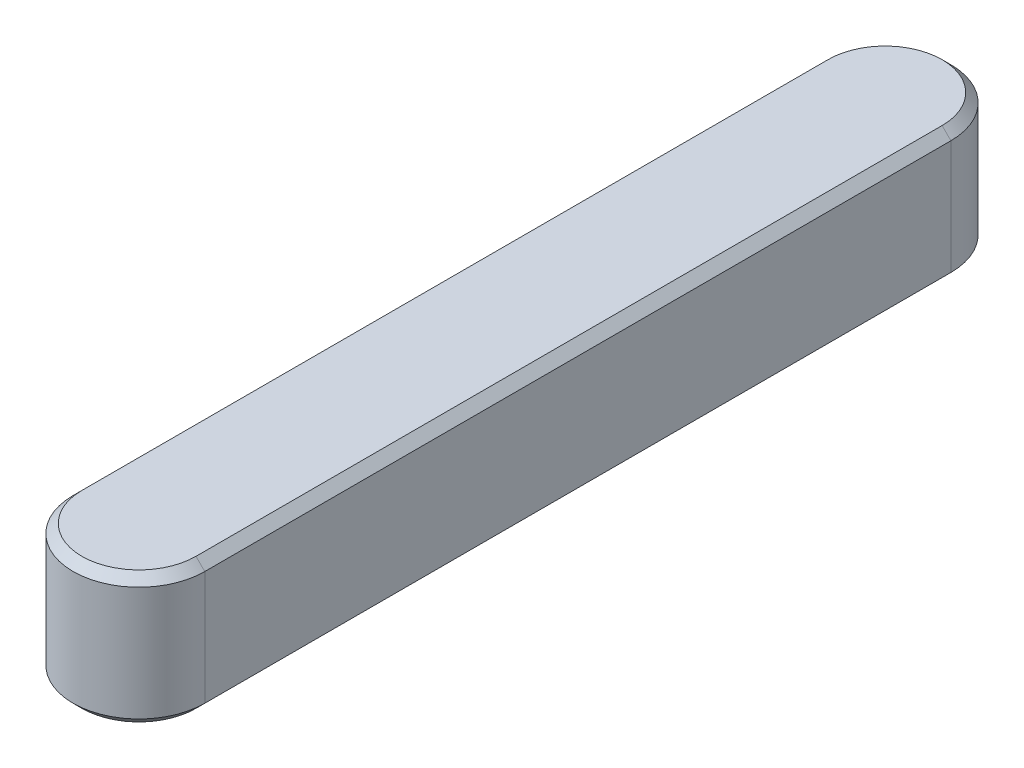
from build123d import *

# Parameters (mm, degrees)
SKETCH1_W          = 3
SKETCH1_H          = 3
EXTRUDE1_DEPTH     = 20
SKETCH2_OUTSIDE_W  = 9.09
SKETCH2_OUTSIDE_H  = 26.09
CUT_EXTRUDE1_DEPTH = 20
CHAMFER1_SIZE      = 0.2


with BuildPart() as part:
    # Sketch1 → Extrude1 (new body)
    with BuildSketch(Plane.XY):
        with Locations((-23.38908046, 12.550287356)):
            Rectangle(SKETCH1_W, SKETCH1_H)
    extrude(amount=EXTRUDE1_DEPTH)

    # Sketch2 outside → Cut-Extrude1 (cut)
    with BuildSketch(Plane(origin=(0, 14.050287356, 0), x_dir=(1, 0, 0), z_dir=(0, 1, 0))):
        with Locations((-23.389, -10)):
            Rectangle(SKETCH2_OUTSIDE_W, SKETCH2_OUTSIDE_H)
        with BuildLine():
            Line((-24.88908046, -1.5), (-24.88908046, -18.5))
            ThreePointArc((-24.88908046, -18.5), (-23.38908046, -20), (-21.88908046, -18.5))
            Line((-21.88908046, -18.5), (-21.88908046, -1.5))
            ThreePointArc((-21.88908046, -1.5), (-23.38908046, 0), (-24.88908046, -1.5))
        make_face(mode=Mode.SUBTRACT)
    extrude(amount=-CUT_EXTRUDE1_DEPTH, mode=Mode.SUBTRACT)

    # Chamfer1
    chamfer1_edges = [part.edges().sort_by_distance(p)[0] for p in [
        (-21.88908046, 14.050287356, 10),
        (-21.88908046, 11.050287356, 10),
        (-24.88908046, 11.050287356, 10),
        (-24.88908046, 14.050287356, 10),
        (-23.38908046, 14.050287356, 20),
        (-23.38908046, 14.050287356, 0),
        (-23.38908046, 11.050287356, 0),
        (-23.38908046, 11.050287356, 20),
    ]]
    chamfer(chamfer1_edges, length=CHAMFER1_SIZE)


solid = part.part
